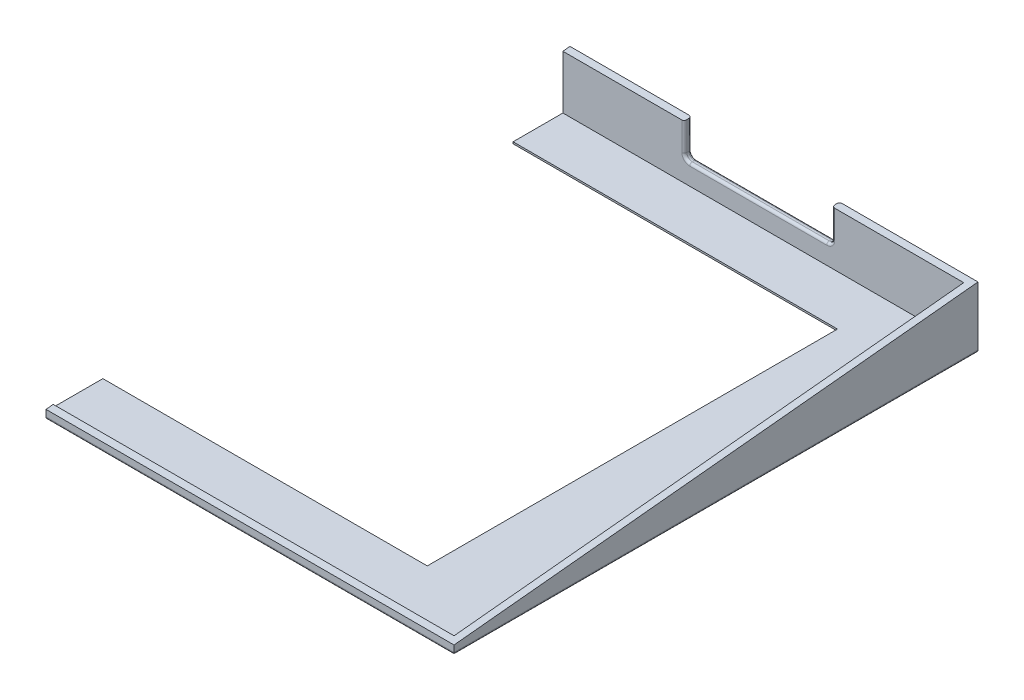
from build123d import *
from OCP.BRepFilletAPI import BRepFilletAPI_MakeChamfer

# Parameters (mm, degrees)
CROQUIS1_W                 = 220.407444928
CROQUIS1_H                 = 139.358729484
CROQUIS1_W_2               = 180
CROQUIS1_H_2               = 113.81
SALIENTE_EXTRUIR1_DEPTH    = 2
EXTRUIR_L_MINA3_DEPTH      = 16.5
EXTRUIR_L_MINA3_DEPTH_BACK = 2
CROQUIS2_W                 = 226.407444928
CROQUIS2_H                 = 145.358729484
CROQUIS2_W_2               = 220.407444928
CROQUIS2_H_2               = 139.358729484
CROQUIS6_W                 = 222.447038553
CROQUIS6_H                 = 141.398323109
CORTAR_EXTRUIR2_DEPTH      = 16.5
CORTAR_EXTRUIR3_REACH      = 240.505
CORTAR_EXTRUIR4_DEPTH      = 1.960406375
REDONDEO2_R                = 0.7
CHAFL_N1_SIZE              = 1.5
CHAFL_N1_SIZE2             = 4.121216129
REDONDEO3_R                = 0.7


with BuildPart() as part:
    # Croquis1 → Saliente-Extruir1 (new body)
    with BuildSketch(Plane(origin=(0, 0, 0), x_dir=(1, 0, 0), z_dir=(0, 1, 0))):
        Rectangle(CROQUIS1_W, CROQUIS1_H)
        Rectangle(CROQUIS1_W_2, CROQUIS1_H_2, mode=Mode.SUBTRACT)
    extrude(amount=SALIENTE_EXTRUIR1_DEPTH)

    # Croquis2 → Extruir-Lámina3 (add, two sides: drawn at the far end of the back side and taken through both)
    with BuildSketch(Plane(origin=(0, 2, 0), x_dir=(1, 0, 0), z_dir=(0, 1, 0)).offset(-EXTRUIR_L_MINA3_DEPTH_BACK)):
        Rectangle(CROQUIS2_W, CROQUIS2_H)
        Rectangle(CROQUIS2_W_2, CROQUIS2_H_2, mode=Mode.SUBTRACT)
    extrude(amount=EXTRUIR_L_MINA3_DEPTH + EXTRUIR_L_MINA3_DEPTH_BACK)

    # Croquis6 → Cortar-Extruir2 (cut)
    with BuildSketch(Plane(origin=(0, 18.5, 0), x_dir=(1, 0, 0), z_dir=(0, 1, 0))):
        with Locations((-0.019796812, 0.019796812)):
            Rectangle(CROQUIS6_W, CROQUIS6_H)
    extrude(amount=-CORTAR_EXTRUIR2_DEPTH, mode=Mode.SUBTRACT)

    # Cortar-Extruir3: up to this face of the body (flat: up to its plane)
    cortar_extruir3_end = Plane(part.part.faces().sort_by_distance((113.203722464, 9.25, 0))[0])
    # Croquis7 → Cortar-Extruir3 (cut, up to the picked face)
    with BuildSketch(Plane.ZY.offset(113.203722464), mode=Mode.PRIVATE) as cortar_extruir3_sk1:
        Polygon((-72.679364742, 18.5), (-72.679364742, 17.034353119), (72.679364742, 2.5), (72.679364742, 18.5), align=None)
    cortar_extruir3_tool1 = split(extrude(cortar_extruir3_sk1.sketch, amount=-CORTAR_EXTRUIR3_REACH, mode=Mode.PRIVATE), bisect_by=cortar_extruir3_end, keep=Keep.BOTH, mode=Mode.PRIVATE)
    add(cortar_extruir3_tool1.solids().sort_by(Axis((-113.203722, 13.12567, 20.160481), (1, 0, 0)))[0], mode=Mode.SUBTRACT)

    # Croquis8 → Cortar-Extruir4 (cut)
    with BuildSketch(Plane(origin=(0, 0, -72.679364742), x_dir=(-1, 0, 0), z_dir=(0, 0, -1))):
        with BuildLine():
            Line((-33.703722464, 17.034353119), (-74.703722464, 17.034353119))
            Line((-74.703722464, 17.034353119), (-74.703722464, 9.034353119))
            ThreePointArc((-74.703722464, 9.034353119), (-74.264382636, 7.973692947), (-73.203722464, 7.534353119))
            Line((-73.203722464, 7.534353119), (-35.203722464, 7.534353119))
            ThreePointArc((-35.203722464, 7.534353119), (-34.143062292, 7.973692947), (-33.703722464, 9.034353119))
            Line((-33.703722464, 9.034353119), (-33.703722464, 17.034353119))
        make_face()
    extrude(amount=-CORTAR_EXTRUIR4_DEPTH, mode=Mode.SUBTRACT)

    # Redondeo2
    redondeo2_edges = [part.edges().sort_by_distance(p)[0] for p in [
        (33.703722464, 12.936343049, -70.718958367),
        (34.143062292, 7.973692947, -70.718958367),
        (54.203722464, 7.534353119, -70.718958367),
        (74.264382636, 7.973692947, -70.718958367),
        (74.703722464, 12.936343049, -70.718958367),
        (74.703722464, 13.034353119, -72.679364742),
        (74.264382636, 7.973692947, -72.679364742),
        (54.203722464, 7.534353119, -72.679364742),
        (34.143062292, 7.973692947, -72.679364742),
        (33.703722464, 13.034353119, -72.679364742),
    ]]
    fillet(redondeo2_edges, radius=REDONDEO2_R)

    # Chaflán1: one chamfer whose edges measure the first distance from different faces: ONE call of the kernel's chamfer builder (chamfer() names one face for all edges)
    chafl_n1_edges_1 = [part.edges().sort_by_distance(p)[0] for p in [
        (90, 0, 0),
    ]]
    chafl_n1_side_1 = [part.faces().sort_by_distance(p)[0] for p in [
        (90, 1, 0),
    ]]
    chafl_n1_edges_2 = [part.edges().sort_by_distance(p)[0] for p in [
        (0, 0, -56.905),
    ]]
    chafl_n1_side_2 = [part.faces().sort_by_distance(p)[0] for p in [
        (0, 1, -56.905),
    ]]
    chafl_n1_edges_3 = [part.edges().sort_by_distance(p)[0] for p in [
        (-90, 0, 0),
    ]]
    chafl_n1_side_3 = [part.faces().sort_by_distance(p)[0] for p in [
        (-90, 1, 0),
    ]]
    chafl_n1_edges_4 = [part.edges().sort_by_distance(p)[0] for p in [
        (0, 0, 56.905),
    ]]
    chafl_n1_side_4 = [part.faces().sort_by_distance(p)[0] for p in [
        (0, 1, 56.905),
    ]]
    chafl_n1 = BRepFilletAPI_MakeChamfer(part.part.solid().wrapped)
    for e in chafl_n1_edges_1:
        chafl_n1.Add(CHAFL_N1_SIZE, CHAFL_N1_SIZE2, e.wrapped, chafl_n1_side_1[0].wrapped)  # the first distance lies on this face
    for e in chafl_n1_edges_2:
        chafl_n1.Add(CHAFL_N1_SIZE, CHAFL_N1_SIZE2, e.wrapped, chafl_n1_side_2[0].wrapped)  # the first distance lies on this face
    for e in chafl_n1_edges_3:
        chafl_n1.Add(CHAFL_N1_SIZE, CHAFL_N1_SIZE2, e.wrapped, chafl_n1_side_3[0].wrapped)  # the first distance lies on this face
    for e in chafl_n1_edges_4:
        chafl_n1.Add(CHAFL_N1_SIZE, CHAFL_N1_SIZE2, e.wrapped, chafl_n1_side_4[0].wrapped)  # the first distance lies on this face
    add(Compound.cast(chafl_n1.Shape()), mode=Mode.REPLACE)

    # Redondeo3
    redondeo3_edges = [part.edges().sort_by_distance(p)[0] for p in [
        (-113.203722464, 0, 0),
        (0, 0, -72.679364742),
        (113.203722464, 0, 0),
        (0, 0, 72.679364742),
    ]]
    fillet(redondeo3_edges, radius=REDONDEO3_R)

    # Partir2
    split(bisect_by=Plane(origin=(0, 0, 0), x_dir=(0, 0, 1), z_dir=(1, 0, 0)), keep=Keep.TOP)


solid = part.part
